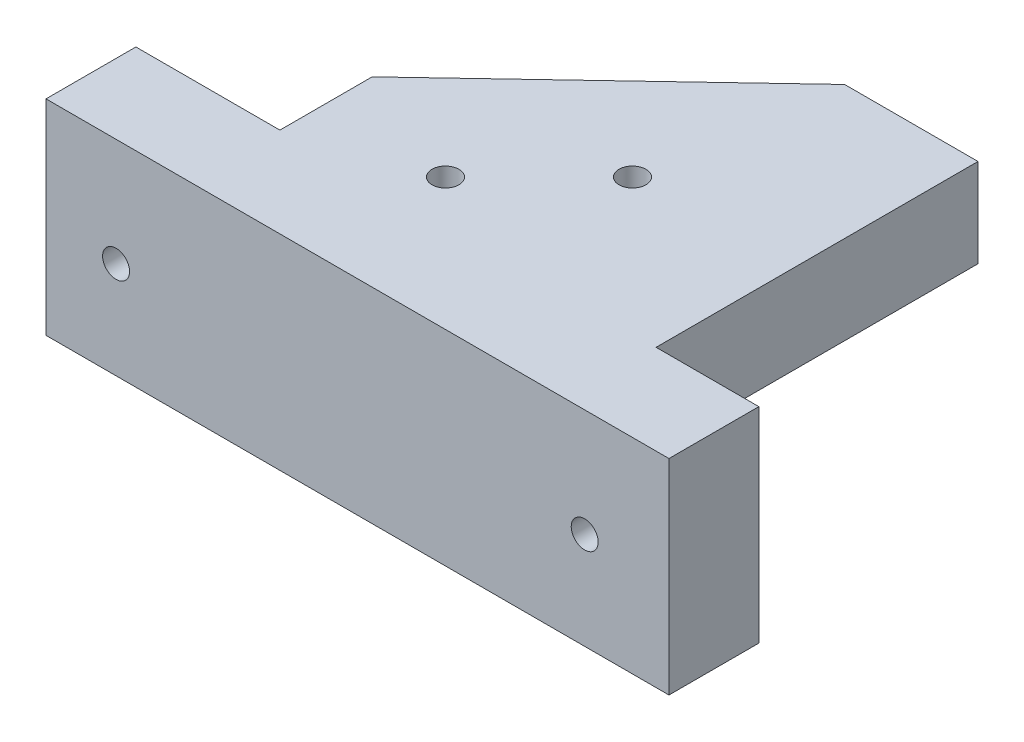
from build123d import *

# Parameters (mm, degrees)
SKETCH1_W            = 103.968410754
SKETCH1_H            = 34.186058554
BOSS_EXTRUDE1_DEPTH  = 15
SKETCH2_W            = 103.968410754
SKETCH2_H            = 14.786910166
BOSS_EXTRUDE2_DEPTH  = 60
CUT_EXTRUDE1_DEPTH   = 94.826164315
M4_CLEARANCE_HOLE1_D = 4.5
M4_CLEARANCE_HOLE2_D = 4.5


with BuildPart() as part:
    # Sketch1 → Boss-Extrude1 (new body)
    with BuildSketch(Plane.XY):
        with Locations((-17.492568813, 2.403154481)):
            Rectangle(SKETCH1_W, SKETCH1_H)
    extrude(amount=BOSS_EXTRUDE1_DEPTH)

    # Sketch2 → Boss-Extrude2 (add)
    with BuildSketch(Plane(origin=(0, 0, 0), x_dir=(-1, 0, 0), z_dir=(0, 0, -1))):
        with Locations((17.492568813, 12.102728675)):
            Rectangle(SKETCH2_W, SKETCH2_H)
    extrude(amount=BOSS_EXTRUDE2_DEPTH)

    # Sketch3 → Cut-Extrude1 (cut, through all)
    with BuildSketch(Plane.XZ.offset(-4.709273592)):
        Polygon((-45.441256031, 0), (-45.441256031, -15.4), (-4.909163254, -53.722384085), (17.34490568, -53.722384085), (17.34490568, 0), (34.491636564, 0), (34.491636564, -60), (-69.47677419, -60), (-69.47677419, 0), align=None)
    extrude(amount=-CUT_EXTRUDE1_DEPTH, mode=Mode.SUBTRACT)

    # M4 Clearance Hole1 (through all)
    with Locations(Plane(origin=(-9.237078097, 4.709273592, -22.640821114), x_dir=(-1, 0, 0), z_dir=(0, -1, 0))):
        with Locations((0, 0), (15.604992815, -15.604992814)):
            Hole(M4_CLEARANCE_HOLE1_D / 2)

    # M4 Clearance Hole2 (through all)
    with Locations(Plane(origin=(-57.782319431, 1.498461161, 0), x_dir=(-1, 0, 0), z_dir=(0, 0, -1))):
        with Locations((0, 0), (-78.208808727, 0)):
            Hole(M4_CLEARANCE_HOLE2_D / 2)


solid = part.part
